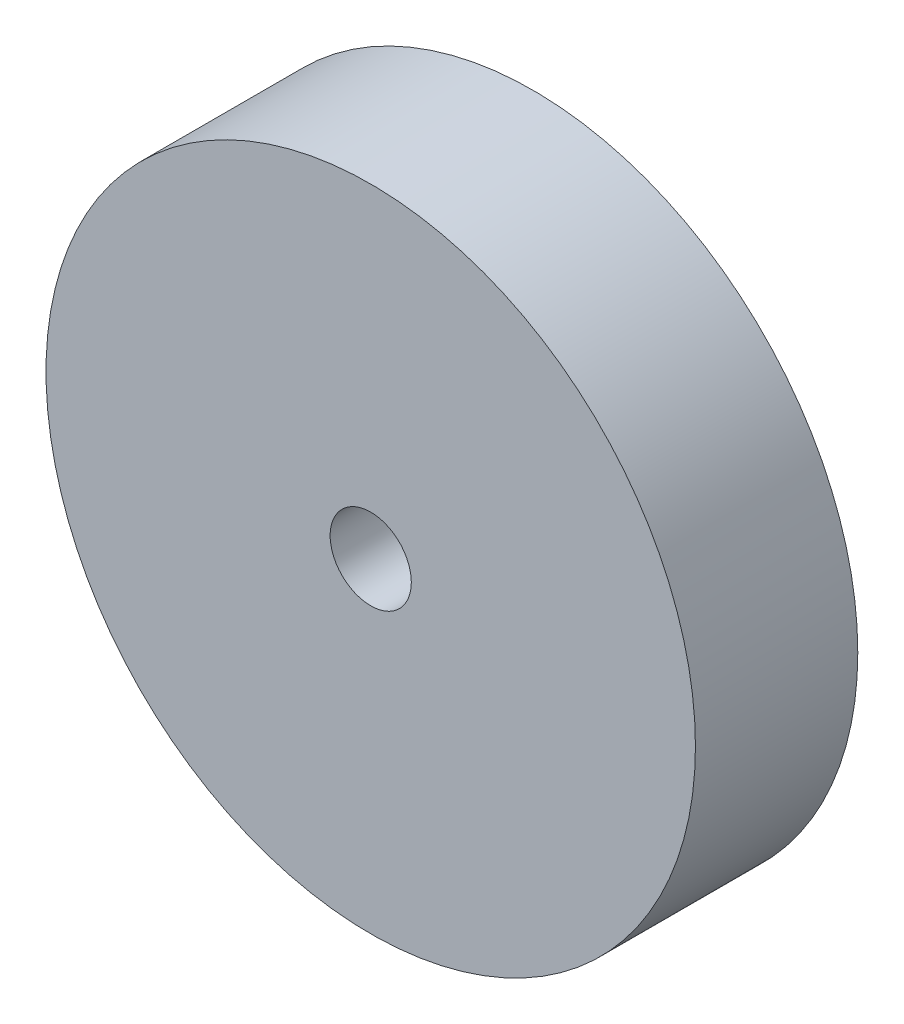
from build123d import *

# Parameters (mm, degrees)
SKETCH1_R           = 20
SKETCH1_R_2         = 2.5
BOSS_EXTRUDE1_DEPTH = 10


with BuildPart() as part:
    # Sketch1 → Boss-Extrude1 (new body)
    with BuildSketch(Plane.XY):
        Circle(SKETCH1_R)
        Circle(SKETCH1_R_2, mode=Mode.SUBTRACT)
    extrude(amount=BOSS_EXTRUDE1_DEPTH)


solid = part.part
